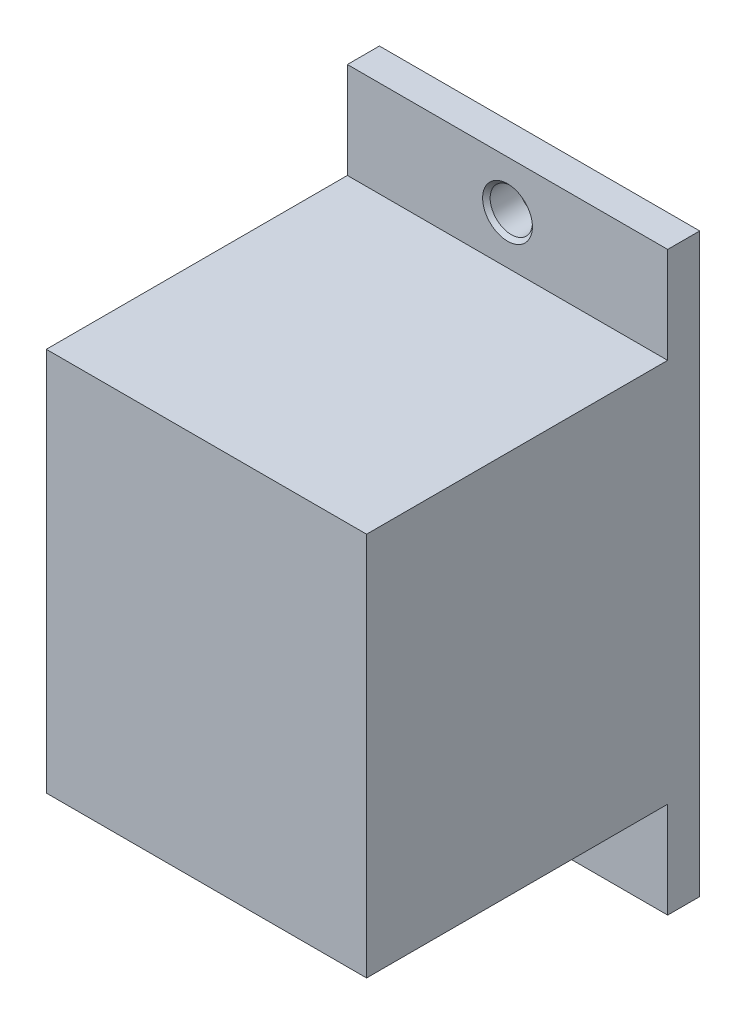
from build123d import *

# Parameters (mm, degrees)
ESBO_O1_W                          = 15
ESBO_O1_H                          = 50
RESSALTO_EXTRUS_O1_DEPTH           = 5
RESSALTO_EXTRUS_O1_2_DEPTH         = 5
ESBO_O1_4_W                        = 60
ESBO_O1_4_H                        = 50
ESBO_O1_4_W_2                      = 56
ESBO_O1_4_H_2                      = 46
RESSALTO_EXTRUS_O2_DEPTH           = 50
ESBO_O3_W                          = 50
ESBO_O3_H                          = 60
RESSALTO_EXTRUS_O3_DEPTH           = 2
FURO_ROSCADO_DE_G1_164_D           = 6.6
FURO_ROSCADO_DE_G1_164_CSINK_D     = 7.773
FURO_ROSCADO_DE_G1_164_CSINK_ANGLE = 90


with BuildPart() as part:
    # Esboço1 → Ressalto-extrusão1 (new body)
    with BuildSketch(Plane(origin=(0, 0, 0), x_dir=(0, 1, 0), z_dir=(0, 0, 1))):
        with Locations((37.5, 0)):
            Rectangle(ESBO_O1_W, ESBO_O1_H)
    extrude(amount=RESSALTO_EXTRUS_O1_DEPTH)



with BuildPart() as body_2:
    # Esboço1 → Ressalto-extrus_o1 2 (new body)
    with BuildSketch(Plane(origin=(0, 0, 0), x_dir=(0, 1, 0), z_dir=(0, 0, 1))):
        with Locations((-37.5, 0)):
            Rectangle(ESBO_O1_W, ESBO_O1_H)
    extrude(amount=RESSALTO_EXTRUS_O1_2_DEPTH)


with BuildPart() as part_1:
    add(part.part)

    add(body_2.part)  # Ressalto-extrusão2 merges body 2
    # Esboço1<4> → Ressalto-extrusão2 (add)
    with BuildSketch(Plane(origin=(0, 0, 0), x_dir=(0, 1, 0), z_dir=(0, 0, 1))):
        Rectangle(ESBO_O1_4_W, ESBO_O1_4_H)
        Rectangle(ESBO_O1_4_W_2, ESBO_O1_4_H_2, mode=Mode.SUBTRACT)
    extrude(amount=RESSALTO_EXTRUS_O2_DEPTH)

    # Esboço3 → Ressalto-extrusão3 (add)
    with BuildSketch(Plane.XY.offset(50)):
        Rectangle(ESBO_O3_W, ESBO_O3_H)
    extrude(amount=RESSALTO_EXTRUS_O3_DEPTH)

    # Furo roscado de G1/164 (through all)
    with Locations(Plane(origin=(0, 0, 5), x_dir=(0, -1, 0), z_dir=(0, 0, 1))):
        with Locations((37.5, 0), (-37.5, 0)):
            CounterSinkHole(FURO_ROSCADO_DE_G1_164_D / 2, FURO_ROSCADO_DE_G1_164_CSINK_D / 2, counter_sink_angle=FURO_ROSCADO_DE_G1_164_CSINK_ANGLE)


solid = part_1.part
